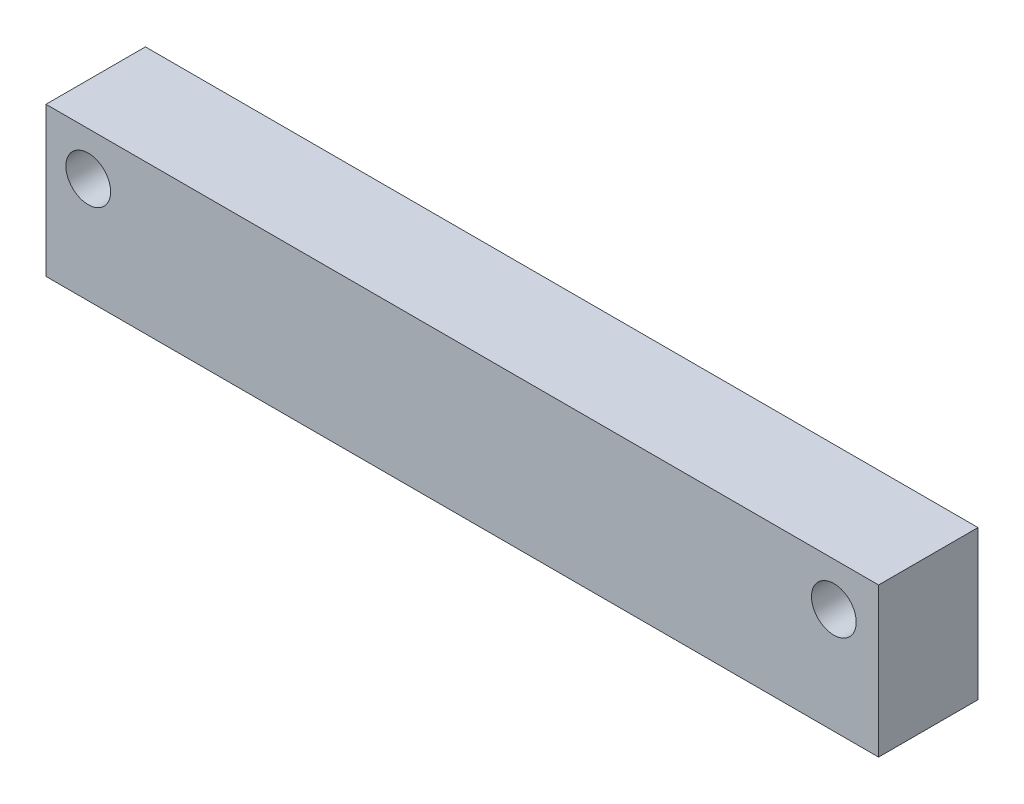
from build123d import *

# Parameters (mm, degrees)
SKETCH2_W            = 13.3
SKETCH2_H            = 12
SKETCH2_W_2          = 40.4
BOSS_EXTRUDE1_DEPTH  = 8.000000075
M3_CLEARANCE_HOLE1_D = 3.6


with BuildPart() as part:
    # Sketch2 → Boss-Extrude1 (new body)
    with BuildSketch(Plane.XY):
        with Locations((74.00000003, 44.5)):
            Rectangle(SKETCH2_W, SKETCH2_H)
        with Locations((100.85000003, 44.5)):
            Rectangle(SKETCH2_W_2, SKETCH2_H)
        with Locations((127.70000003, 44.5)):
            Rectangle(SKETCH2_W, SKETCH2_H)
    extrude(amount=BOSS_EXTRUDE1_DEPTH)

    # M3 Clearance Hole1 (through all)
    with Locations(Plane(origin=(2.6e-08, 0, 8.00000029), x_dir=(1.0, 0, -3.199998676446638e-09), z_dir=(3.199998676446638e-09, 0, 1.0))):
        with Locations((70.750000016, 47), (130.750000016, 47)):
            Hole(M3_CLEARANCE_HOLE1_D / 2)


solid = part.part
